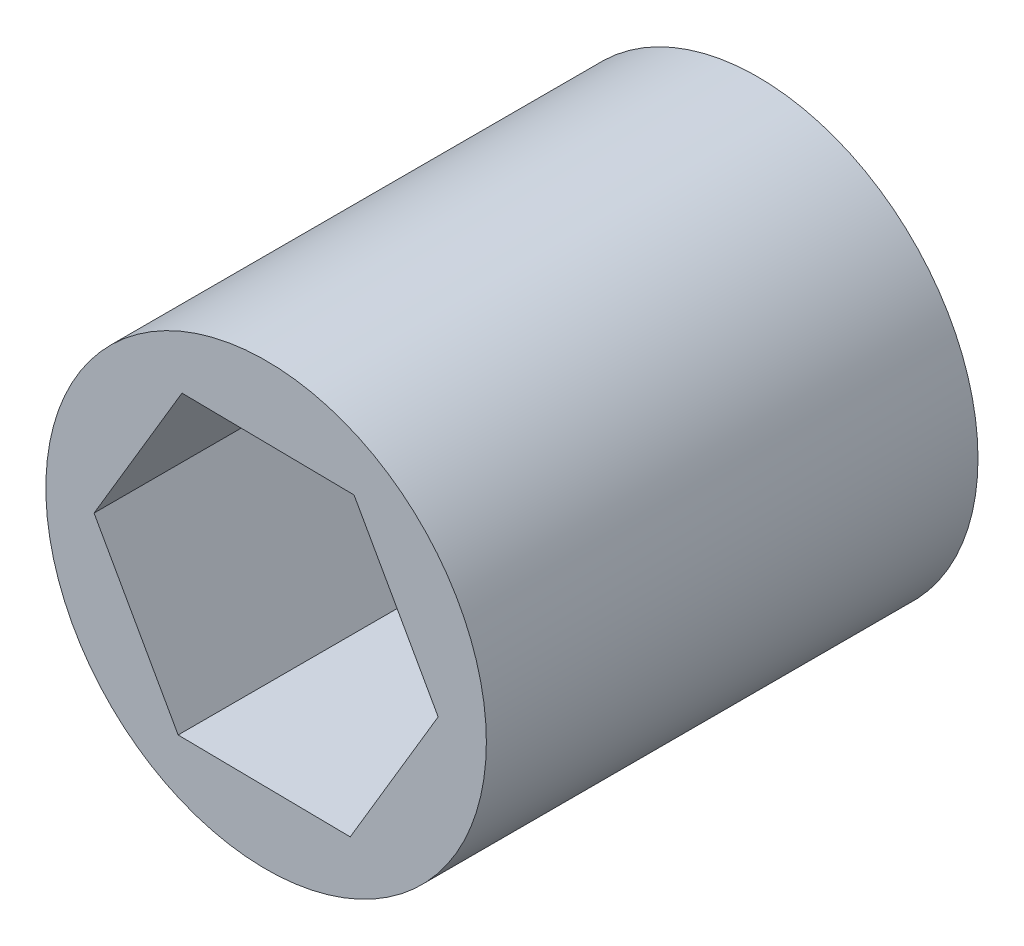
from build123d import *

# Parameters (mm, degrees)
SKETCH1_R           = 8.960518563
BOSS_EXTRUDE1_DEPTH = 20


with BuildPart() as part:
    # Sketch1 → Boss-Extrude1 (new body)
    with BuildSketch(Plane.XY):
        Circle(SKETCH1_R)
        Polygon((-3.4217432, 6.106690878), (-6.999421033, 0.090028903), (-3.577677833, -6.016661975), (3.4217432, -6.106690878), (6.999421033, -0.090028903), (3.577677833, 6.016661975), align=None, mode=Mode.SUBTRACT)
    extrude(amount=BOSS_EXTRUDE1_DEPTH)


solid = part.part
